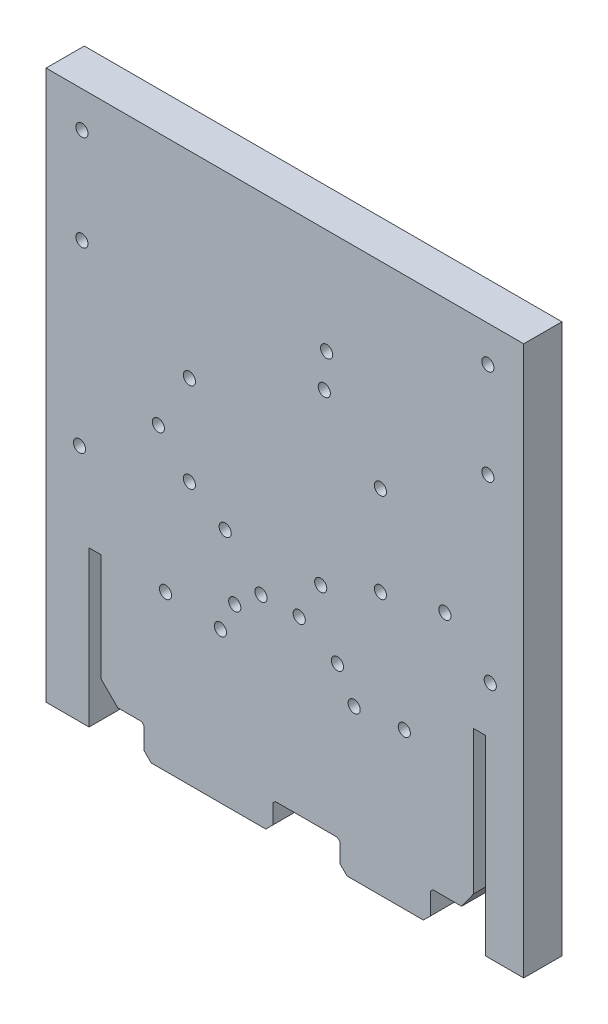
from build123d import *

# Parameters (mm, degrees)
BOARD_OUTLINE_DEPTH = 0.8
SKETCH2_R           = 0.127
NPTH_DEPTH          = 16.260733927


with BuildPart() as part:
    # Sketch1 → Board_Outline (new body)
    with BuildSketch(Plane.XY):
        Polygon((10, 0), (10, 11.5), (0, 11.5), (0, 0), (0.9, 0), (0.9, 3.25), (1.15, 3.25), (1.15, 1), (1.5, 0.65), (2, 0.65), (2.05, 0.6), (2.05, 0.15), (2.2, 0), (4.6, 0), (4.75, 0.15), (4.75, 0.55), (4.8, 0.6), (6.1, 0.6), (6.15, 0.55), (6.15, 0.15), (6.3, 0), (7.9, 0), (8.05, 0.15), (8.05, 0.6), (8.1, 0.65), (8.7, 0.65), (8.95, 1), (8.95, 4), (9.2, 4), (9.2, 0), align=None)
    extrude(amount=BOARD_OUTLINE_DEPTH)

    # Sketch2 → NPTH (cut, through all)
    with BuildSketch(Plane.XY):
        with Locations((4.5, 4.2)):
            Circle(SKETCH2_R)
        with Locations((5.875, 9.3)):
            Circle(SKETCH2_R)
        with Locations((5.3, 4.2)):
            Circle(SKETCH2_R)
        with Locations((5.825, 8.575)):
            Circle(SKETCH2_R)
        with Locations((7.5, 3.25)):
            Circle(SKETCH2_R)
        with Locations((2.5, 3.25)):
            Circle(SKETCH2_R)
        with Locations((3.75, 5)):
            Circle(SKETCH2_R)
        with Locations((5.75, 5)):
            Circle(SKETCH2_R)
        with Locations((7, 5.5)):
            Circle(SKETCH2_R)
        with Locations((3, 5.5)):
            Circle(SKETCH2_R)
        with Locations((3, 7.375)):
            Circle(SKETCH2_R)
        with Locations((7, 7.375)):
            Circle(SKETCH2_R)
        with Locations((9.25, 8.75)):
            Circle(SKETCH2_R)
        with Locations((0.75, 8.75)):
            Circle(SKETCH2_R)
        with Locations((9.25, 10.75)):
            Circle(SKETCH2_R)
        with Locations((0.75, 10.75)):
            Circle(SKETCH2_R)
        with Locations((9.3, 5)):
            Circle(SKETCH2_R)
        with Locations((0.7, 5)):
            Circle(SKETCH2_R)
        with Locations((3.95, 3.75)):
            Circle(SKETCH2_R)
        with Locations((8.35, 5.8)):
            Circle(SKETCH2_R)
        with Locations((6.1, 3.75)):
            Circle(SKETCH2_R)
        with Locations((3.65, 3.15)):
            Circle(SKETCH2_R)
        with Locations((6.45, 3.15)):
            Circle(SKETCH2_R)
        with Locations((2.35, 6.2)):
            Circle(SKETCH2_R)
    extrude(amount=NPTH_DEPTH, mode=Mode.SUBTRACT)


solid = part.part
